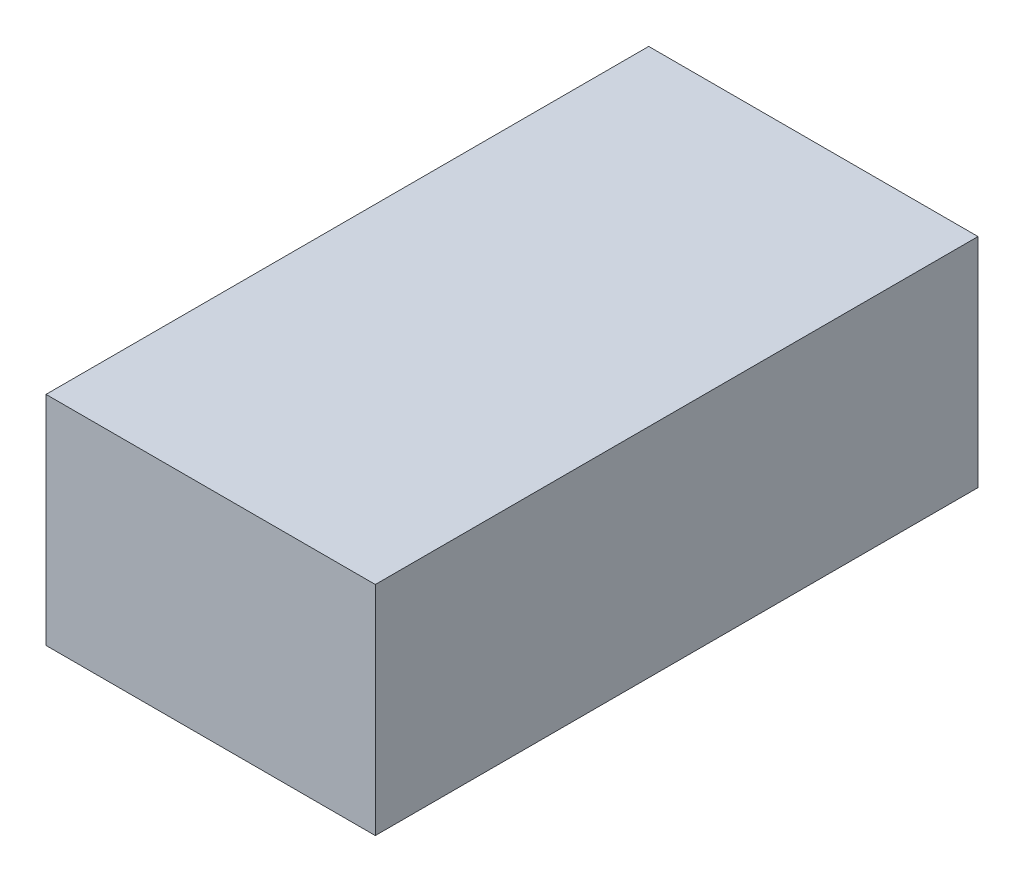
from build123d import *

# Parameters (mm, degrees)
SKETCH1_W           = 26.5
SKETCH1_H           = 17.5
BOSS_EXTRUDE1_DEPTH = 48.5


with BuildPart() as part:
    # Sketch1 → Boss-Extrude1 (new body)
    with BuildSketch(Plane.XY):
        with Locations((13.25, -8.75)):
            Rectangle(SKETCH1_W, SKETCH1_H)
    extrude(amount=BOSS_EXTRUDE1_DEPTH)


solid = part.part
